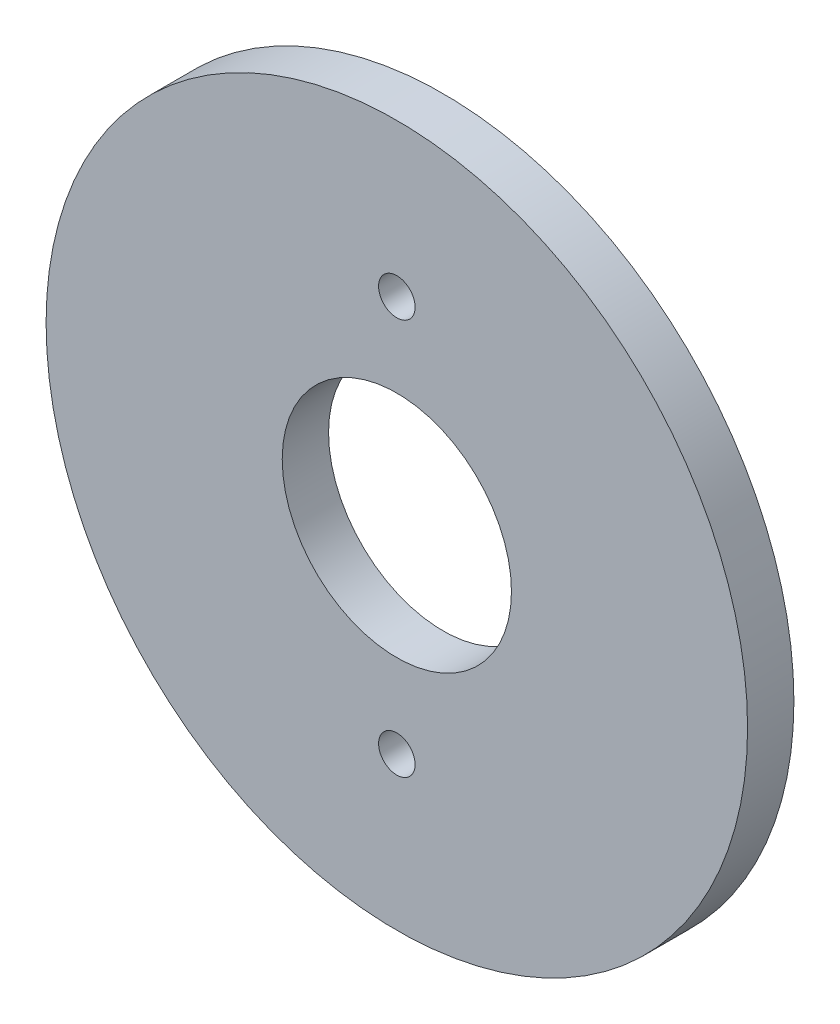
from build123d import *

# Parameters (mm, degrees)
SKETCH1_R           = 33.655
SKETCH1_R_2         = 1.7526
SKETCH1_R_3         = 10.9982
BOSS_EXTRUDE1_DEPTH = 4.445


with BuildPart() as part:
    # Sketch1 → Boss-Extrude1 (new body)
    with BuildSketch(Plane.XY):
        Circle(SKETCH1_R)
        with Locations((0, 18.9992)):
            Circle(SKETCH1_R_2, mode=Mode.SUBTRACT)
        Circle(SKETCH1_R_3, mode=Mode.SUBTRACT)
        with Locations((0, -18.9992)):
            Circle(SKETCH1_R_2, mode=Mode.SUBTRACT)
    extrude(amount=BOSS_EXTRUDE1_DEPTH)


solid = part.part
